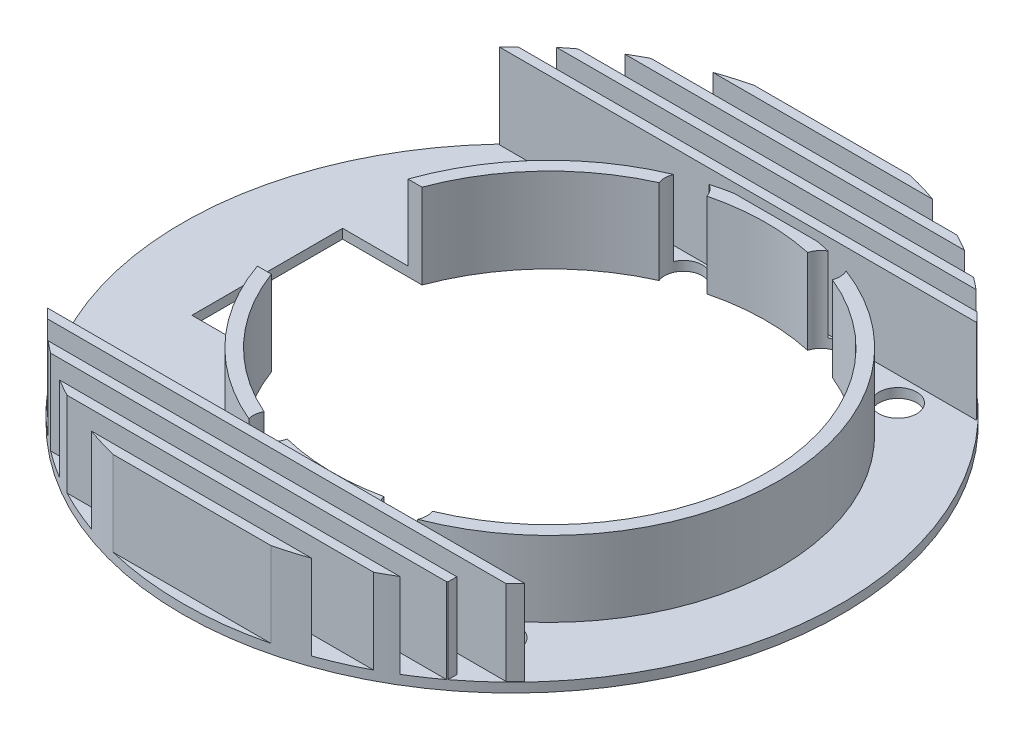
from build123d import *

# Parameters (mm, degrees)
SKETCH1_R           = 17.5
BOSS_EXTRUDE1_DEPTH = 0.5
SKETCH2_R           = 11.5
CUT_EXTRUDE1_DEPTH  = 0.5
SKETCH3_W           = 15
SKETCH3_H           = 8
CUT_EXTRUDE4_DEPTH  = 2.5
BOSS_EXTRUDE6_DEPTH = 4.5
BOSS_EXTRUDE7_START = 4
SKETCH9_R           = 12.2
SKETCH9_R_2         = 11.5
BOSS_EXTRUDE7_DEPTH = 4
SKETCH10_W          = 4.218070674
SKETCH10_H          = 8
CUT_EXTRUDE5_DEPTH  = 6
SKETCH11_R          = 1
SKETCH11_R_2        = 0.998714777
SKETCH11_R_3        = 0.998671431
SKETCH11_R_4        = 1.032567444
SKETCH11_R_5        = 1.008118798
CUT_EXTRUDE7_DEPTH  = 100


with BuildPart() as part:
    # Sketch1 → Boss-Extrude1 (new body)
    with BuildSketch(Plane(origin=(0, 0, 0), x_dir=(1, 0, 0), z_dir=(0, 1, 0))):
        with Locations(Location((0, 0, 0), (0, 0, 270))):
            Circle(SKETCH1_R)
    extrude(amount=BOSS_EXTRUDE1_DEPTH)

    # Sketch2 → Cut-Extrude1 (cut)
    with BuildSketch(Plane(origin=(0, 0.5, 0), x_dir=(1, 0, 0), z_dir=(0, 1, 0))):
        with Locations(Location((2, 0, 0), (0, 0, 270))):
            Circle(SKETCH2_R)
    extrude(amount=-CUT_EXTRUDE1_DEPTH, mode=Mode.SUBTRACT)

    # Sketch3 → Cut-Extrude4 (cut)
    with BuildSketch(Plane(origin=(0, 0, 0), x_dir=(1, 0, 0), z_dir=(0, 1, 0))):
        with Locations((-5.5, 0)):
            Rectangle(SKETCH3_W, SKETCH3_H)
    extrude(amount=CUT_EXTRUDE4_DEPTH, mode=Mode.SUBTRACT)

    # Sketch7 → Boss-Extrude6 (add)
    with BuildSketch(Plane(origin=(0, 0.5, 0), x_dir=(1, 0, 0), z_dir=(0, 1, 0))):
        with BuildLine():
            Line((-11.135528726, 13.5), (11.135528726, 13.5))
            ThreePointArc((11.135528726, 13.5), (10.820652744, 13.753671299), (10.5, 14))
            Line((10.5, 14), (-10.5, 14))
            ThreePointArc((-10.5, 14), (-10.820652744, 13.753671299), (-11.135528726, 13.5))
        make_face()
        with BuildLine():
            Line((12.176537068, 12.5), (-12.176537068, 12.5))
            ThreePointArc((-12.176537068, 12.5), (-12.42556977, 12.252480192), (-12.669572012, 12))
            Line((-12.669572012, 12), (12.669572012, 12))
            ThreePointArc((12.669572012, 12), (12.42556977, 12.252480192), (12.176537068, 12.5))
        make_face()
        with BuildLine():
            ThreePointArc((-11.145229996, -13.491992008), (-10.830835088, -13.74565427), (-10.510668849, -13.991992008))
            Line((-10.510668849, -13.991992008), (10.510668849, -13.991992008))
            ThreePointArc((10.510668849, -13.991992008), (10.53333572, -13.974936086), (10.555974914, -13.957843444))
            Line((10.555974914, -13.957843444), (10.555974914, -13.491992008))
            Line((10.555974914, -13.491992008), (-11.145229996, -13.491992008))
        make_face()
        with BuildLine():
            Line((-9.013878189, 15), (9.013878189, 15))
            ThreePointArc((9.013878189, 15), (8.572604405, 15.256488905), (8.124038405, 15.5))
            Line((8.124038405, 15.5), (-8.124038405, 15.5))
            ThreePointArc((-8.124038405, 15.5), (-8.572604405, 15.256488905), (-9.013878189, 15))
        make_face()
        with BuildLine():
            ThreePointArc((-9.027190906, -14.991992008), (-8.586884855, -15.248455938), (-8.139298719, -15.491992008))
            Line((-8.139298719, -15.491992008), (8.139298719, -15.491992008))
            ThreePointArc((8.139298719, -15.491992008), (8.586884855, -15.248455938), (9.027190906, -14.991992008))
            Line((9.027190906, -14.991992008), (-9.027190906, -14.991992008))
        make_face()
        with BuildLine():
            Line((-5.830951895, 16.5), (5.830951895, 16.5))
            ThreePointArc((5.830951895, 16.5), (4.998387844, 16.770990399), (4.153311931, 17))
            Line((4.153311931, 17), (-4.153311931, 17))
            ThreePointArc((-4.153311931, 17), (-4.998387844, 16.770990399), (-5.830951895, 16.5))
        make_face()
        with BuildLine():
            Line((5.853562985, -16.491992008), (-5.853562985, -16.491992008))
            ThreePointArc((-5.853562985, -16.491992008), (-5.025979841, -16.762742217), (-4.185953609, -16.991992008))
            Line((-4.185953609, -16.991992008), (4.185953609, -16.991992008))
            ThreePointArc((4.185953609, -16.991992008), (5.025979841, -16.762742217), (5.853562985, -16.491992008))
        make_face()
        with BuildLine():
            Line((12.669572012, -12), (-12.669572012, -12))
            ThreePointArc((-12.669572012, -12), (-12.42556977, -12.252480192), (-12.176537068, -12.5))
            Line((-12.176537068, -12.5), (12.176537068, -12.5))
            ThreePointArc((12.176537068, -12.5), (12.42556977, -12.252480192), (12.669572012, -12))
        make_face()
    extrude(amount=BOSS_EXTRUDE6_DEPTH)

    # Sketch9 → Boss-Extrude7 (add)
    with BuildSketch(Plane(origin=(0, 0.5, 0), x_dir=(1, 0, 0), z_dir=(0, 1, 0)).offset(BOSS_EXTRUDE7_START)):
        with Locations((2, 0)):
            Circle(SKETCH9_R)
        with Locations(Location((2, 0, 0), (0, 0, 270))):
            Circle(SKETCH9_R_2, mode=Mode.SUBTRACT)
    extrude(amount=-BOSS_EXTRUDE7_DEPTH)

    # Sketch10 → Cut-Extrude5 (cut)
    with BuildSketch(Plane.XZ):
        with Locations((-10.890964663, 0)):
            Rectangle(SKETCH10_W, SKETCH10_H)
    extrude(amount=-CUT_EXTRUDE5_DEPTH, mode=Mode.SUBTRACT)

    # Sketch11 → Cut-Extrude7 (cut)
    with BuildSketch(Plane.XZ):
        with Locations(Location((-7.340296828, -10.142549821, 0), (0, 0, 270))):
            Circle(SKETCH11_R)
        with Locations((-1.767569388, -10.865331146)):
            Circle(SKETCH11_R_2)
        with Locations((5.429630438, -10.976685978)):
            Circle(SKETCH11_R_3)
        with Locations(Location((-7.340296828, 9.917402438, 0), (0, 0, 270))):
            Circle(SKETCH11_R)
        with Locations((5.429630438, 10.976685978)):
            Circle(SKETCH11_R_4)
        with Locations((-1.767569388, 10.976685978)):
            Circle(SKETCH11_R)
        with Locations(Location((10.013638897, 10.643798729, 0), (0, 0, 270))):
            Circle(SKETCH11_R_5)
        with Locations(Location((9.772353005, -10.712194768, 0), (0, 0, 270))):
            Circle(SKETCH11_R)
    extrude(amount=-CUT_EXTRUDE7_DEPTH, mode=Mode.SUBTRACT)


solid = part.part
